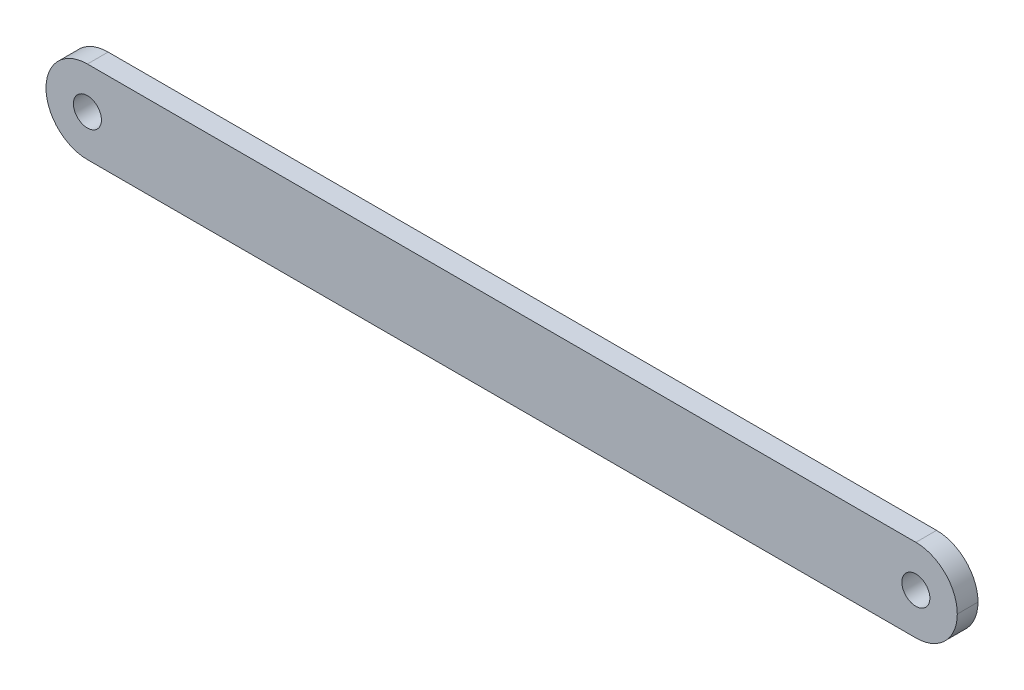
from build123d import *

# Parameters (mm, degrees)
SKETCH_1_R      = 1.354010502
EXTRUDE_1_DEPTH = 2


with BuildPart() as part:
    # 草图1 → 凸台-拉伸1 (new body)
    with BuildSketch(Plane.XY.offset(3)):
        with BuildLine():
            Line((55.860222099, 7.999), (-24.138320535, 7.999))
            ThreePointArc((-24.138320535, 7.999), (-26.96674766, 6.827427125), (-28.138320535, 3.999))
            ThreePointArc((-28.138320535, 3.999), (-26.966394209, 1.171219344), (-24.13832066, 0))
            Line((-24.13832066, 0), (55.860221974, 0))
            ThreePointArc((55.860221974, 0), (58.688649099, 1.171572875), (59.860221974, 4))
            ThreePointArc((59.860221974, 4), (58.688295648, 6.827780656), (55.860222099, 7.999))
        make_face()
        with Locations(Location((55.859733508, 3.999511534, 0), (0, 0, 180))):
            Circle(SKETCH_1_R, mode=Mode.SUBTRACT)
        with Locations(Location((-24.138809001, 3.998511534, 0), (0, 0, 180))):
            Circle(SKETCH_1_R, mode=Mode.SUBTRACT)
    extrude(amount=-EXTRUDE_1_DEPTH)


solid = part.part
